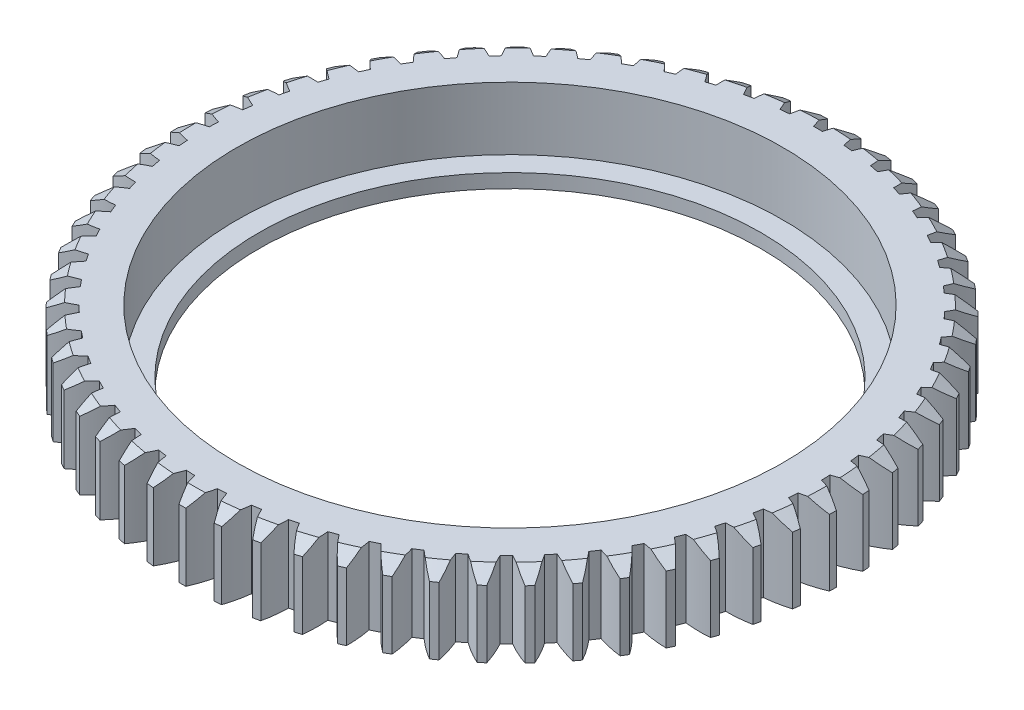
from build123d import *

# Parameters (mm, degrees)
SKETCH1_R           = 47.5
BOSS_EXTRUDE1_DEPTH = 11
SKETCH2_R           = 39.15
CUT_EXTRUDE1_DEPTH  = 9
SKETCH3_R           = 36
CUT_EXTRUDE2_DEPTH  = 68.775364256
SKETCH4_R           = 56.496532513
CUT_EXTRUDE3_DEPTH  = 69.0698171


with BuildPart() as part:
    # Sketch1 → Boss-Extrude1 (new body)
    with BuildSketch(Plane(origin=(0, 0, 0), x_dir=(1, 0, 0), z_dir=(0, 1, 0))):
        with Locations(Location((0, 0, 0), (0, 0, 270))):
            Circle(SKETCH1_R)
    extrude(amount=BOSS_EXTRUDE1_DEPTH)

    # Sketch2 → Cut-Extrude1 (cut)
    with BuildSketch(Plane(origin=(0, 11, 0), x_dir=(1, 0, 0), z_dir=(0, 1, 0))):
        with Locations(Location((0, 0, 0), (0, 0, 270))):
            Circle(SKETCH2_R)
    extrude(amount=-CUT_EXTRUDE1_DEPTH, mode=Mode.SUBTRACT)

    # Sketch3 → Cut-Extrude2 (cut, through all)
    with BuildSketch(Plane(origin=(0, 2, 0), x_dir=(1, 0, 0), z_dir=(0, 1, 0))):
        with Locations(Location((0, 0, 0), (0, 0, 270))):
            Circle(SKETCH3_R)
    extrude(amount=-CUT_EXTRUDE2_DEPTH, mode=Mode.SUBTRACT)

    # Sketch4 → Cut-Extrude3 (cut, through all)
    with BuildSketch(Plane(origin=(0, 11, 0), x_dir=(1, 0, 0), z_dir=(0, 1, 0))):
        with Locations((0.194948757, 0.084919291)):
            Circle(SKETCH4_R)
        with BuildLine():
            ThreePointArc((-46.949557382, 3.240555667), (-45.330598285, 2.465090454), (-43.643452181, 1.851973113))
            ThreePointArc((-43.643452181, 1.851973113), (-43.664505587, 1.214583255), (-43.676292132, 0.576954715))
            ThreePointArc((-43.676292132, 0.576954715), (-45.39276375, 0.051502493), (-47.049496235, -0.639592525))
            ThreePointArc((-47.049496235, -0.639592525), (-47.039386333, -1.131669629), (-47.024151314, -1.623614729))
            ThreePointArc((-47.024151314, -1.623614729), (-45.334038796, -2.228506891), (-43.592793439, -2.664900589))
            ThreePointArc((-43.592793439, -2.664900589), (-43.548198198, -3.301076935), (-43.494360671, -3.936537868))
            ThreePointArc((-43.494360671, -3.936537868), (-45.147707254, -4.635694451), (-46.724599773, -5.493473466))
            ThreePointArc((-46.724599773, -5.493473466), (-46.663947596, -5.98190299), (-46.598211039, -6.469674239))
            ThreePointArc((-46.598211039, -6.469674239), (-44.854860712, -6.897581344), (-43.077973737, -7.152625517))
            ThreePointArc((-43.077973737, -7.152625517), (-42.96820257, -7.780844721), (-42.849311662, -8.407402005))
            ThreePointArc((-42.849311662, -8.407402005), (-44.422007326, -9.272851715), (-45.902344424, -10.288222055))
            ThreePointArc((-45.902344424, -10.288222055), (-45.7917929, -10.767826525), (-45.676251629, -11.246253428))
            ThreePointArc((-45.676251629, -11.246253428), (-43.89814344, -11.492639552), (-42.104450291, -11.563630669))
            ThreePointArc((-42.104450291, -11.563630669), (-41.9306668, -12.177233453), (-41.747982784, -12.788245423))
            ThreePointArc((-41.747982784, -12.788245423), (-43.223356563, -13.810814279), (-44.5914463, -14.973012766))
            ThreePointArc((-44.5914463, -14.973012766), (-44.432167303, -15.438708254), (-44.268046083, -15.902719366))
            ThreePointArc((-44.268046083, -15.902719366), (-42.474028422, -15.964972757), (-40.682542693, -15.851158294))
            ThreePointArc((-40.682542693, -15.851158294), (-40.446589026, -16.443640315), (-40.202048398, -17.032630093))
            ThreePointArc((-40.202048398, -17.032630093), (-41.564460962, -18.201478609), (-42.805801246, -19.498185651))
            ThreePointArc((-42.805801246, -19.498185651), (-42.599483174, -19.94503567), (-42.388521732, -20.389712358))
            ThreePointArc((-42.388521732, -20.389712358), (-40.597611632, -20.267173113), (-38.827323516, -19.969759532))
            ThreePointArc((-38.827323516, -19.969759532), (-38.531700841, -20.534840333), (-38.227895792, -21.09556448))
            ThreePointArc((-38.227895792, -21.09556448), (-39.462905231, -22.398302573), (-40.564337545, -23.815772752))
            ThreePointArc((-40.564337545, -23.815772752), (-40.31316742, -24.239040581), (-40.057601999, -24.659669161))
            ThreePointArc((-40.057601999, -24.659669161), (-38.288783553, -24.353636227), (-36.558458545, -23.875776185))
            ThreePointArc((-36.558458545, -23.875776185), (-36.206300536, -24.407465769), (-35.846451475, -24.933980471))
            ThreePointArc((-35.846451475, -24.933980471), (-36.940966381, -26.356798792), (-37.89081527, -27.880006571))
            ThreePointArc((-37.89081527, -27.880006571), (-37.597455557, -28.275205465), (-37.299995215, -28.66732717))
            ThreePointArc((-37.299995215, -28.66732717), (-35.572018338, -28.181044572), (-33.899998314, -27.527803506))
            ThreePointArc((-33.899998314, -27.527803506), (-33.495037932, -28.020465831), (-33.08295935, -28.507189901))
            ThreePointArc((-33.08295935, -28.507189901), (-34.025377592, -30.035006221), (-34.813574421, -31.64780522))
            ThreePointArc((-34.813574421, -31.64780522), (-34.481134807, -32.010745972), (-34.144932697, -32.370204214))
            ThreePointArc((-34.144932697, -32.370204214), (-32.476114374, -31.708826669), (-30.880123162, -30.887129095))
            ThreePointArc((-30.880123162, -30.887129095), (-30.426653089, -31.335541819), (-29.966713121, -31.77731586))
            ThreePointArc((-29.966713121, -31.77731586), (-30.747044831, -33.393934947), (-31.365234518, -35.079229094))
            ThreePointArc((-31.365234518, -35.079229094), (-30.997238945, -35.406064443), (-30.625858893, -35.729048875))
            ThreePointArc((-30.625858893, -35.729048875), (-29.033889013, -34.89958715), (-27.530844517, -33.918143267))
            ThreePointArc((-27.530844517, -33.918143267), (-27.033671649, -34.317553103), (-26.530745772, -34.7096942))
            ThreePointArc((-26.530745772, -34.7096942), (-27.14071924, -36.39797949), (-27.58234882, -38.137904248))
            ThreePointArc((-27.58234882, -38.137904248), (-27.182698133, -38.425169657), (-26.78007686, -38.708256565))
            ThreePointArc((-26.78007686, -38.708256565), (-25.281830701, -37.719503159), (-23.887665566, -36.588716517))
            ThreePointArc((-23.887665566, -36.588716517), (-23.352060058, -36.934889621), (-22.811479412, -37.273240981))
            ThreePointArc((-22.811479412, -37.273240981), (-23.244628769, -39.015296229), (-23.505016858, -40.791407964))
            ThreePointArc((-23.505016858, -40.791407964), (-23.077947454, -41.036058348), (-22.648352846, -41.276246939))
            ThreePointArc((-22.648352846, -41.276246939), (-21.259712188, -40.138682885), (-19.989204912, -38.870540104))
            ThreePointArc((-19.989204912, -38.870540104), (-19.420844316, -39.159806955), (-18.848339191, -39.44078197))
            ThreePointArc((-18.848339191, -39.44078197), (-19.100072944, -41.218140957), (-19.176459365, -43.011612442))
            ThreePointArc((-19.176459365, -43.011612442), (-18.726498285, -43.211054446), (-18.274484151, -43.405798662))
            ThreePointArc((-18.274484151, -43.405798662), (-17.010168933, -42.131482422), (-15.876787208, -40.73942613))
            ThreePointArc((-15.876787208, -40.73942613), (-15.281696288, -40.968720428), (-14.68333538, -41.189340692))
            ThreePointArc((-14.68333538, -41.189340692), (-14.75098509, -42.983162971), (-14.642560127, -44.774982962))
            ThreePointArc((-14.642560127, -44.774982962), (-14.17447707, -44.927102452), (-13.704834873, -45.074337955))
            ThreePointArc((-13.704834873, -45.074337955), (-12.578247149, -43.676777598), (-11.594005105, -42.175563939))
            ThreePointArc((-11.594005105, -42.175563939), (-10.978491972, -42.342455107), (-10.360618056, -42.500381991))
            ThreePointArc((-10.360618056, -42.500381991), (-10.243466618, -44.291652599), (-9.951379603, -46.062827359))
            ThreePointArc((-9.951379603, -46.062827359), (-9.470136367, -46.16601183), (-8.987844431, -46.264177888))
            ThreePointArc((-8.987844431, -46.264177888), (-8.010926311, -44.758187901), (-7.186257158, -43.163730113))
            ThreePointArc((-7.186257158, -43.163730113), (-6.556846405, -43.266449062), (-5.926009098, -43.360008502))
            ThreePointArc((-5.926009098, -43.360008502), (-5.625298347, -45.129739526), (-5.152645474, -46.86149416))
            ThreePointArc((-5.152645474, -46.86149416), (-4.663343358, -46.914649832), (-4.173514097, -46.96270586))
            ThreePointArc((-4.173514097, -46.96270586), (-3.356621157, -45.364250112), (-2.700266592, -43.693449844))
            ThreePointArc((-2.700266592, -43.693449844), (-2.06363013, -43.730907729), (-1.426516463, -43.759107971))
            ThreePointArc((-1.426516463, -43.759107971), (-0.945434009, -45.488539821), (-0.297225517, -47.162517301))
            ThreePointArc((-0.297225517, -47.162517301), (0.194948757, -47.165080709), (0.687123031, -47.162517301))
            ThreePointArc((0.687123031, -47.162517301), (1.335331523, -45.488539821), (1.816413977, -43.759107971))
            ThreePointArc((1.816413977, -43.759107971), (2.453527644, -43.730907729), (3.090164106, -43.693449844))
            ThreePointArc((3.090164106, -43.693449844), (3.746518671, -45.364250112), (4.563411611, -46.96270586))
            ThreePointArc((4.563411611, -46.96270586), (5.053240872, -46.914649832), (5.542542988, -46.86149416))
            ThreePointArc((5.542542988, -46.86149416), (6.015195861, -45.129739526), (6.315906612, -43.360008502))
            ThreePointArc((6.315906612, -43.360008502), (6.946743919, -43.266449062), (7.576154672, -43.163730113))
            ThreePointArc((7.576154672, -43.163730113), (8.400823825, -44.758187901), (9.377741945, -46.264177888))
            ThreePointArc((9.377741945, -46.264177888), (9.860033881, -46.16601183), (10.341277117, -46.062827359))
            ThreePointArc((10.341277117, -46.062827359), (10.633364132, -44.291652599), (10.75051557, -42.500381991))
            ThreePointArc((10.75051557, -42.500381991), (11.368389486, -42.342455107), (11.983902619, -42.175563939))
            ThreePointArc((11.983902619, -42.175563939), (12.968144663, -43.676777598), (14.094732387, -45.074337955))
            ThreePointArc((14.094732387, -45.074337955), (14.564374584, -44.927102452), (15.032457641, -44.774982962))
            ThreePointArc((15.032457641, -44.774982962), (15.140882604, -42.983162971), (15.073232894, -41.189340692))
            ThreePointArc((15.073232894, -41.189340692), (15.671593802, -40.968720428), (16.266684722, -40.73942613))
            ThreePointArc((16.266684722, -40.73942613), (17.400066446, -42.131482422), (18.664381665, -43.405798662))
            ThreePointArc((18.664381665, -43.405798662), (19.116395799, -43.211054446), (19.566356879, -43.011612442))
            ThreePointArc((19.566356879, -43.011612442), (19.489970458, -41.218140957), (19.238236705, -39.44078197))
            ThreePointArc((19.238236705, -39.44078197), (19.81074183, -39.159806955), (20.379102426, -38.870540104))
            ThreePointArc((20.379102426, -38.870540104), (21.649609702, -40.138682885), (23.03825036, -41.276246939))
            ThreePointArc((23.03825036, -41.276246939), (23.467844968, -41.036058348), (23.894914372, -40.791407964))
            ThreePointArc((23.894914372, -40.791407964), (23.634526283, -39.015296229), (23.201376926, -37.273240981))
            ThreePointArc((23.201376926, -37.273240981), (23.741957572, -36.934889621), (24.27756308, -36.588716517))
            ThreePointArc((24.27756308, -36.588716517), (25.671728215, -37.719503159), (27.169974374, -38.708256565))
            ThreePointArc((27.169974374, -38.708256565), (27.572595647, -38.425169657), (27.972246334, -38.137904248))
            ThreePointArc((27.972246334, -38.137904248), (27.530616754, -36.39797949), (26.920643286, -34.7096942))
            ThreePointArc((26.920643286, -34.7096942), (27.423569163, -34.317553103), (27.920742031, -33.918143267))
            ThreePointArc((27.920742031, -33.918143267), (29.423786527, -34.89958715), (31.015756407, -35.729048875))
            ThreePointArc((31.015756407, -35.729048875), (31.387136459, -35.406064443), (31.755132032, -35.079229094))
            ThreePointArc((31.755132032, -35.079229094), (31.136942345, -33.393934947), (30.356610634, -31.77731586))
            ThreePointArc((30.356610634, -31.77731586), (30.816550603, -31.335541819), (31.270020676, -30.887129095))
            ThreePointArc((31.270020676, -30.887129095), (32.866011888, -31.708826669), (34.534830211, -32.370204214))
            ThreePointArc((34.534830211, -32.370204214), (34.871032321, -32.010745972), (35.203471935, -31.64780522))
            ThreePointArc((35.203471935, -31.64780522), (34.415275106, -30.035006221), (33.472856864, -28.507189901))
            ThreePointArc((33.472856864, -28.507189901), (33.884935446, -28.020465831), (34.289895828, -27.527803506))
            ThreePointArc((34.289895828, -27.527803506), (35.961915852, -28.181044572), (37.689892729, -28.66732717))
            ThreePointArc((37.689892729, -28.66732717), (37.987353071, -28.275205465), (38.280712784, -27.880006571))
            ThreePointArc((38.280712784, -27.880006571), (37.330863895, -26.356798792), (36.236348989, -24.933980471))
            ThreePointArc((36.236348989, -24.933980471), (36.59619805, -24.407465769), (36.948356059, -23.875776185))
            ThreePointArc((36.948356059, -23.875776185), (38.678681067, -24.353636227), (40.447499513, -24.659669161))
            ThreePointArc((40.447499513, -24.659669161), (40.703064934, -24.239040581), (40.954235059, -23.815772752))
            ThreePointArc((40.954235059, -23.815772752), (39.852802744, -22.398302573), (38.617793306, -21.09556448))
            ThreePointArc((38.617793306, -21.09556448), (38.921598355, -20.534840333), (39.21722103, -19.969759532))
            ThreePointArc((39.21722103, -19.969759532), (40.987509146, -20.267173113), (42.778419245, -20.389712358))
            ThreePointArc((42.778419245, -20.389712358), (42.989380688, -19.94503567), (43.19569876, -19.498185651))
            ThreePointArc((43.19569876, -19.498185651), (41.954358476, -18.201478609), (40.591945912, -17.032630093))
            ThreePointArc((40.591945912, -17.032630093), (40.83648654, -16.443640315), (41.072440207, -15.851158294))
            ThreePointArc((41.072440207, -15.851158294), (42.863925936, -15.964972757), (44.657943597, -15.902719366))
            ThreePointArc((44.657943597, -15.902719366), (44.822064817, -15.438708254), (44.981343814, -14.973012766))
            ThreePointArc((44.981343814, -14.973012766), (43.613254077, -13.810814279), (42.137880298, -12.788245423))
            ThreePointArc((42.137880298, -12.788245423), (42.320564314, -12.177233453), (42.494347805, -11.563630669))
            ThreePointArc((42.494347805, -11.563630669), (44.288040954, -11.492639552), (46.066149143, -11.246253428))
            ThreePointArc((46.066149143, -11.246253428), (46.181690414, -10.767826525), (46.292241938, -10.288222055))
            ThreePointArc((46.292241938, -10.288222055), (44.81190484, -9.272851715), (43.239209176, -8.407402005))
            ThreePointArc((43.239209176, -8.407402005), (43.358100084, -7.780844721), (43.467871251, -7.152625517))
            ThreePointArc((43.467871251, -7.152625517), (45.244758226, -6.897581344), (46.988108553, -6.469674239))
            ThreePointArc((46.988108553, -6.469674239), (47.05384511, -5.98190299), (47.114497287, -5.493473466))
            ThreePointArc((47.114497287, -5.493473466), (45.537604768, -4.635694451), (43.884258185, -3.936537868))
            ThreePointArc((43.884258185, -3.936537868), (43.938095712, -3.301076935), (43.982690953, -2.664900589))
            ThreePointArc((43.982690953, -2.664900589), (45.72393631, -2.228506891), (47.414048828, -1.623614729))
            ThreePointArc((47.414048828, -1.623614729), (47.429283847, -1.131669629), (47.439393749, -0.639592525))
            ThreePointArc((47.439393749, -0.639592525), (45.782661264, 0.051502493), (44.066189646, 0.576954715))
            ThreePointArc((44.066189646, 0.576954715), (44.054403101, 1.214583255), (44.033349695, 1.851973113))
            ThreePointArc((44.033349695, 1.851973113), (45.720495799, 2.465090454), (47.339454896, 3.240555667))
            ThreePointArc((47.339454896, 3.240555667), (47.304026882, 3.731459876), (47.263487342, 4.221968421))
            ThreePointArc((47.263487342, 4.221968421), (45.544476666, 4.739053663), (43.783075039, 5.085231599))
            ThreePointArc((43.783075039, 5.085231599), (43.705789362, 5.718268725), (43.619310481, 6.350115605))
            ThreePointArc((43.619310481, 6.350115605), (45.234473165, 7.133457393), (46.76511747, 8.071275533))
            ThreePointArc((46.76511747, 8.071275533), (46.679401969, 8.555935145), (46.588642716, 9.039675617))
            ThreePointArc((46.588642716, 9.039675617), (44.82557579, 9.377269851), (43.037915451, 9.54050393))
            ThreePointArc((43.037915451, 9.54050393), (42.895949889, 10.162239289), (42.74496223, 10.781845458))
            ThreePointArc((42.74496223, 10.781845458), (44.271020367, 11.727108075), (45.697124671, 12.817338035))
            ThreePointArc((45.697124671, 12.817338035), (45.562030288, 13.290615538), (45.422013392, 13.762460168))
            ThreePointArc((45.422013392, 13.762460168), (43.633579165, 13.916984812), (41.838609757, 13.895544711))
            ThreePointArc((41.838609757, 13.895544711), (41.633469181, 14.499387755), (41.419573251, 15.100185232))
            ThreePointArc((41.419573251, 15.100185232), (42.840350246, 16.197348659), (44.146797488, 17.428433731))
            ThreePointArc((44.146797488, 17.428433731), (43.963756257, 17.885312265), (43.775965933, 18.340259384))
            ThreePointArc((43.775965933, 18.340259384), (41.981122251, 18.310076437), (40.197870897, 18.104189427))
            ThreePointArc((40.197870897, 18.104189427), (39.931729847, 18.683739269), (39.657192997, 19.259359452))
            ThreePointArc((39.657192997, 19.259359452), (40.95762826, 20.496793483), (42.130569774, 21.85568386))
            ThreePointArc((42.130569774, 21.85568386), (41.901521978, 22.291320399), (41.66794885, 22.724547453))
            ThreePointArc((41.66794885, 22.724547453), (39.885721503, 22.509976862), (38.133091111, 22.121825397))
            ThreePointArc((38.133091111, 22.121825397), (37.808770749, 22.670938664), (37.476503137, 23.215279837))
            ThreePointArc((37.476503137, 23.215279837), (38.64281173, 24.579867364), (39.669814045, 26.052158468))
            ThreePointArc((39.669814045, 26.052158468), (39.397187647, 26.461935157), (39.120307648, 26.868849832))
            ThreePointArc((39.120307648, 26.868849832), (37.369588691, 26.472166099), (35.666157578, 25.90586468))
            ThreePointArc((35.666157578, 25.90586468), (35.287095781, 26.418720636), (34.900619527, 26.926012645))
            ThreePointArc((34.900619527, 26.926012645), (35.920438288, 28.403288701), (36.790614924, 29.973373882))
            ThreePointArc((36.790614924, 29.973373882), (36.477299832, 30.352946984), (36.160047959, 30.729235883))
            ThreePointArc((36.160047959, 30.729235883), (34.459395446, 30.154643954), (32.823220407, 29.416195518))
            ThreePointArc((32.823220407, 29.416195518), (32.393435324, 29.887357762), (31.956847172, 30.352223186))
            ThreePointArc((31.956847172, 30.352223186), (32.81936577, 31.926528277), (33.523492637, 33.577764241))
            ThreePointArc((33.523492637, 33.577764241), (33.17281007, 33.923110189), (32.818549271, 34.264784556))
            ThreePointArc((32.818549271, 34.264784556), (31.185990543, 33.518375248), (29.63441544, 32.615607532))
            ThreePointArc((29.63441544, 32.615607532), (29.158462899, 33.040081626), (28.676390792, 33.457592777))
            ThreePointArc((28.676390792, 33.457592777), (29.372466315, 35.112238877), (29.903079494, 36.827122111))
            ThreePointArc((29.903079494, 36.827122111), (29.518746773, 37.134580152), (29.131232302, 37.438018153))
            ThreePointArc((29.131232302, 37.438018153), (27.584072888, 36.527703592), (26.133544802, 35.470186157))
            ThreePointArc((26.133544802, 35.470186157), (25.61647002, 35.843472571), (25.094024042, 36.209203726))
            ThreePointArc((25.094024042, 36.209203726), (25.616277916, 37.926651176), (25.967752775, 39.687003492))
            ThreePointArc((25.967752775, 39.687003492), (25.553843923, 39.953314492), (25.137183528, 40.215299611))
            ThreePointArc((25.137183528, 40.215299611), (23.691823703, 39.150729356), (22.357718594, 37.949672151))
            ThreePointArc((22.357718594, 37.949672151), (21.80500269, 38.267813956), (21.247720899, 38.577888274))
            ThreePointArc((21.247720899, 38.577888274), (21.590617104, 40.339931703), (21.759227922, 42.127092928))
            ThreePointArc((21.759227922, 42.127092928), (21.320130476, 42.349433926), (20.878740862, 42.567189053))
            ThreePointArc((20.878740862, 42.567189053), (19.550501798, 41.359647815), (18.346961511, 40.027782345))
            ThreePointArc((18.346961511, 40.027782345), (17.764463414, 40.287407158), (17.178253134, 40.538537774))
            ThreePointArc((17.178253134, 40.538537774), (17.338156884, 42.326499084), (17.322116345, 44.121524864))
            ThreePointArc((17.322116345, 44.121524864), (16.862484846, 44.29753899), (16.401044853, 44.468755868))
            ThreePointArc((16.401044853, 44.468755868), (15.204006216, 43.131043884), (14.143788578, 41.682488254))
            ThreePointArc((14.143788578, 41.682488254), (13.537682911, 41.880843988), (12.928758119, 42.070368855))
            ThreePointArc((12.928758119, 42.070368855), (12.903974394, 43.86529521), (12.70345253, 45.649157827))
            ThreePointArc((12.70345253, 45.649157827), (12.228159188, 45.776979287), (11.751560194, 45.899842974))
            ThreePointArc((11.751560194, 45.899842974), (10.698410891, 44.446140323), (9.792754473, 42.896249584))
            ThreePointArc((9.792754473, 42.896249584), (9.169466106, 43.031233619), (8.544281556, 43.157143726))
            ThreePointArc((8.544281556, 43.157143726), (8.33507307, 44.940008461), (7.952195464, 46.693798526))
            ThreePointArc((7.952195464, 46.693798526), (7.466278506, 46.772072381), (6.979572579, 46.845280491))
            ThreePointArc((6.979572579, 46.845280491), (6.081476254, 45.290996784), (5.339981239, 43.656200162))
            ThreePointArc((5.339981239, 43.656200162), (4.706117185, 43.726381634), (4.071299988, 43.787342303))
            ThreePointArc((4.071299988, 43.787342303), (3.679884403, 45.539246608), (3.118709654, 47.24437351))
            ThreePointArc((3.118709654, 47.24437351), (2.62731992, 47.272270038), (2.135666264, 47.295046547))
            ThreePointArc((2.135666264, 47.295046547), (1.402142962, 45.656657577), (0.832669381, 43.954284324))
            ThreePointArc((0.832669381, 43.954284324), (0.194948757, 43.958919291), (-0.442771867, 43.954284324))
            ThreePointArc((-0.442771867, 43.954284324), (-1.012245448, 45.656657577), (-1.74576875, 47.295046547))
            ThreePointArc((-1.74576875, 47.295046547), (-2.237422406, 47.272270038), (-2.72881214, 47.24437351))
            ThreePointArc((-2.72881214, 47.24437351), (-3.289986889, 45.539246608), (-3.681402474, 43.787342303))
            ThreePointArc((-3.681402474, 43.787342303), (-4.316219671, 43.726381634), (-4.950083725, 43.656200162))
            ThreePointArc((-4.950083725, 43.656200162), (-5.69157874, 45.290996784), (-6.589675065, 46.845280491))
            ThreePointArc((-6.589675065, 46.845280491), (-7.076380992, 46.772072381), (-7.56229795, 46.693798526))
            ThreePointArc((-7.56229795, 46.693798526), (-7.945175556, 44.940008461), (-8.154384042, 43.157143726))
            ThreePointArc((-8.154384042, 43.157143726), (-8.779568592, 43.031233619), (-9.402856959, 42.896249584))
            ThreePointArc((-9.402856959, 42.896249584), (-10.308513377, 44.446140323), (-11.36166268, 45.899842974))
            ThreePointArc((-11.36166268, 45.899842974), (-11.838261674, 45.776979287), (-12.313555016, 45.649157827))
            ThreePointArc((-12.313555016, 45.649157827), (-12.51407688, 43.86529521), (-12.538860605, 42.070368855))
            ThreePointArc((-12.538860605, 42.070368855), (-13.147785397, 41.880843988), (-13.753891064, 41.682488254))
            ThreePointArc((-13.753891064, 41.682488254), (-14.814108702, 43.131043884), (-16.011147339, 44.468755868))
            ThreePointArc((-16.011147339, 44.468755868), (-16.472587332, 44.29753899), (-16.932218831, 44.121524864))
            ThreePointArc((-16.932218831, 44.121524864), (-16.94825937, 42.326499084), (-16.788355621, 40.538537774))
            ThreePointArc((-16.788355621, 40.538537774), (-17.3745659, 40.287407158), (-17.957063997, 40.027782345))
            ThreePointArc((-17.957063997, 40.027782345), (-19.160604284, 41.359647815), (-20.488843348, 42.567189053))
            ThreePointArc((-20.488843348, 42.567189053), (-20.930232962, 42.349433926), (-21.369330408, 42.127092928))
            ThreePointArc((-21.369330408, 42.127092928), (-21.20071959, 40.339931703), (-20.857823385, 38.577888274))
            ThreePointArc((-20.857823385, 38.577888274), (-21.415105176, 38.267813956), (-21.96782108, 37.949672151))
            ThreePointArc((-21.96782108, 37.949672151), (-23.301926189, 39.150729356), (-24.747286014, 40.215299611))
            ThreePointArc((-24.747286014, 40.215299611), (-25.163946409, 39.953314492), (-25.577855261, 39.687003492))
            ThreePointArc((-25.577855261, 39.687003492), (-25.226380402, 37.926651176), (-24.704126528, 36.209203726))
            ThreePointArc((-24.704126528, 36.209203726), (-25.226572506, 35.843472571), (-25.743647288, 35.470186157))
            ThreePointArc((-25.743647288, 35.470186157), (-27.194175374, 36.527703592), (-28.741334788, 37.438018153))
            ThreePointArc((-28.741334788, 37.438018153), (-29.128849259, 37.134580152), (-29.51318198, 36.827122111))
            ThreePointArc((-29.51318198, 36.827122111), (-28.982568801, 35.112238877), (-28.286493278, 33.457592777))
            ThreePointArc((-28.286493278, 33.457592777), (-28.768565385, 33.040081626), (-29.244517926, 32.615607532))
            ThreePointArc((-29.244517926, 32.615607532), (-30.796093029, 33.518375248), (-32.428651757, 34.264784556))
            ThreePointArc((-32.428651757, 34.264784556), (-32.782912556, 33.923110189), (-33.133595123, 33.577764241))
            ThreePointArc((-33.133595123, 33.577764241), (-32.429468256, 31.926528277), (-31.566949658, 30.352223186))
            ThreePointArc((-31.566949658, 30.352223186), (-32.00353781, 29.887357762), (-32.433322893, 29.416195518))
            ThreePointArc((-32.433322893, 29.416195518), (-34.069497932, 30.154643954), (-35.770150445, 30.729235883))
            ThreePointArc((-35.770150445, 30.729235883), (-36.087402318, 30.352946984), (-36.40071741, 29.973373882))
            ThreePointArc((-36.40071741, 29.973373882), (-35.530540774, 28.403288701), (-34.510722013, 26.926012645))
            ThreePointArc((-34.510722013, 26.926012645), (-34.897198267, 26.418720636), (-35.276260064, 25.90586468))
            ThreePointArc((-35.276260064, 25.90586468), (-36.979691177, 26.472166099), (-38.730410134, 26.868849832))
            ThreePointArc((-38.730410134, 26.868849832), (-39.007290133, 26.461935157), (-39.279916531, 26.052158468))
            ThreePointArc((-39.279916531, 26.052158468), (-38.252914216, 24.579867364), (-37.086605624, 23.215279837))
            ThreePointArc((-37.086605624, 23.215279837), (-37.418873235, 22.670938664), (-37.743193597, 22.121825397))
            ThreePointArc((-37.743193597, 22.121825397), (-39.495823989, 22.509976862), (-41.278051336, 22.724547453))
            ThreePointArc((-41.278051336, 22.724547453), (-41.511624464, 22.291320399), (-41.74067226, 21.85568386))
            ThreePointArc((-41.74067226, 21.85568386), (-40.567730746, 20.496793483), (-39.267295483, 19.259359452))
            ThreePointArc((-39.267295483, 19.259359452), (-39.541832333, 18.683739269), (-39.807973383, 18.104189427))
            ThreePointArc((-39.807973383, 18.104189427), (-41.591224737, 18.310076437), (-43.386068419, 18.340259384))
            ThreePointArc((-43.386068419, 18.340259384), (-43.573858743, 17.885312265), (-43.756899974, 17.428433731))
            ThreePointArc((-43.756899974, 17.428433731), (-42.450452732, 16.197348659), (-41.029675737, 15.100185232))
            ThreePointArc((-41.029675737, 15.100185232), (-41.243571667, 14.499387755), (-41.448712243, 13.895544711))
            ThreePointArc((-41.448712243, 13.895544711), (-43.243681651, 13.916984812), (-45.032115878, 13.762460168))
            ThreePointArc((-45.032115878, 13.762460168), (-45.172132774, 13.290615538), (-45.307227157, 12.817338035))
            ThreePointArc((-45.307227157, 12.817338035), (-43.881122853, 11.727108075), (-42.355064716, 10.781845458))
            ThreePointArc((-42.355064716, 10.781845458), (-42.506052375, 10.162239289), (-42.648017937, 9.54050393))
            ThreePointArc((-42.648017937, 9.54050393), (-44.435678276, 9.377269851), (-46.198745202, 9.039675617))
            ThreePointArc((-46.198745202, 9.039675617), (-46.289504455, 8.555935145), (-46.375219956, 8.071275533))
            ThreePointArc((-46.375219956, 8.071275533), (-44.844575651, 7.133457393), (-43.229412967, 6.350115605))
            ThreePointArc((-43.229412967, 6.350115605), (-43.315891848, 5.718268725), (-43.393177525, 5.085231599))
            ThreePointArc((-43.393177525, 5.085231599), (-45.154579152, 4.739053663), (-46.873589828, 4.221968421))
            ThreePointArc((-46.873589828, 4.221968421), (-46.914129368, 3.731459876), (-46.949557382, 3.240555667))
        make_face(mode=Mode.SUBTRACT)
    extrude(amount=-CUT_EXTRUDE3_DEPTH, mode=Mode.SUBTRACT)

    # Sketch6 → Cut-Revolve2 (revolve, cut)
    with BuildSketch(Plane(origin=(0, 0, 0), x_dir=(0, 0, -1), z_dir=(1, 0, 0))):
        Polygon((-48.976114755, 8.548005018), (-42.910110479, 12.434039007), (-52.10389821, 14.045321393), align=None)
    revolve(axis=Axis((0, 0, 0), (0, 1, 0)), mode=Mode.SUBTRACT)


solid = part.part
